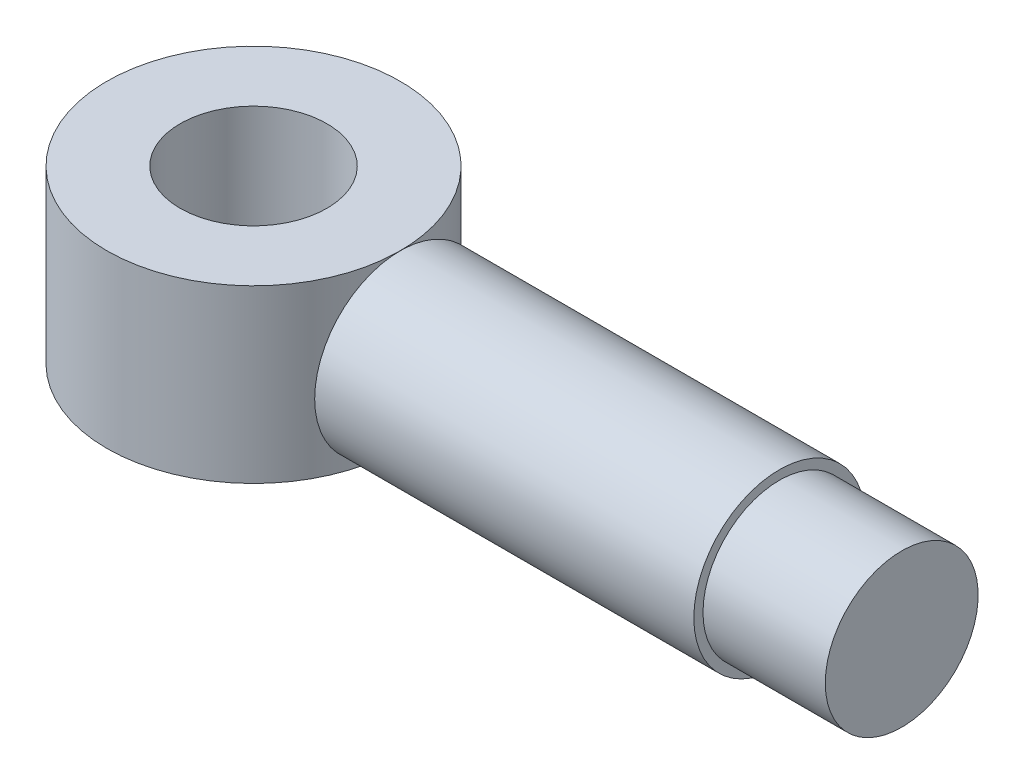
from build123d import *

# Parameters (mm, degrees)
SKETCH1_R           = 24
SKETCH1_R_2         = 12
BOSS_EXTRUDE1_DEPTH = 28
SKETCH2_W           = 62
SKETCH2_H           = 14
SKETCH3_R           = 12.5
BOSS_EXTRUDE2_DEPTH = 20


with BuildPart() as part:
    # Sketch1 → Boss-Extrude1 (new body)
    with BuildSketch(Plane(origin=(0, 0, 0), x_dir=(1, 0, 0), z_dir=(0, 1, 0))):
        with Locations(Location((0, 0, 0), (0, 0, 270))):
            Circle(SKETCH1_R)
        with Locations(Location((0, 0, 0), (0, 0, 270))):
            Circle(SKETCH1_R_2, mode=Mode.SUBTRACT)
    extrude(amount=BOSS_EXTRUDE1_DEPTH)


with BuildPart() as body_2:
    # Sketch2 → Revolve1 (revolve)
    with BuildSketch(Plane.XY, mode=Mode.PRIVATE) as revolve1_sk:
        with Locations((55, 21)):
            Rectangle(SKETCH2_W, SKETCH2_H)
    revolve(revolve1_sk.sketch.rotate(Axis((-976, 14, 0), (1, 0, 0)), 90), axis=Axis((-976, 14, 0), (1, 0, 0)))

    # Sketch3 → Boss-Extrude2 (add)
    with BuildSketch(Plane(origin=(86, 0, 0), x_dir=(0, 0, -1), z_dir=(1, 0, 0))):
        with Locations(Location((0, 14, 0), (0, 0, 180))):
            Circle(SKETCH3_R)
    extrude(amount=BOSS_EXTRUDE2_DEPTH)


solid = Compound([part.part, body_2.part])
